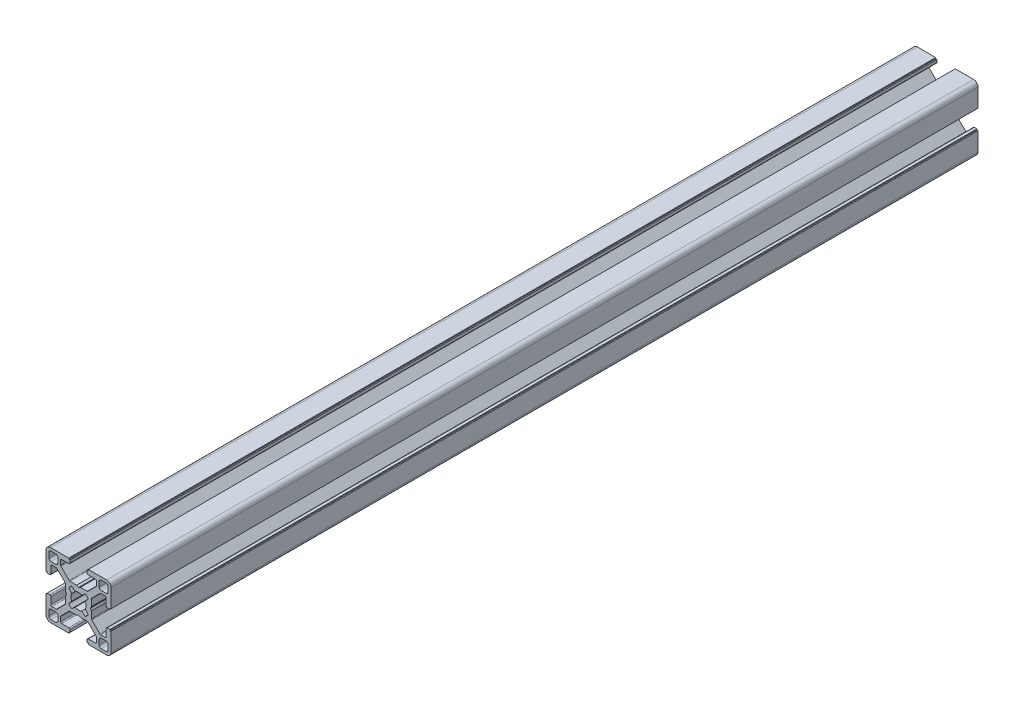
from build123d import *

# Parameters (mm, degrees)
BOSS_EXTRUDE1_DEPTH = 200
CIRPATTERN1_COUNT   = 4


with BuildPart() as part:
    # Sketch3 → Boss-Extrude1 (new, symmetric)
    with BuildSketch(Plane.XY):
        with BuildLine():
            Line((-4.503841895, 3.156803476), (-3.14772708, 1.530298739))
            ThreePointArc((-3.14772708, 1.530298739), (-3.410794979, 0.785160882), (-3.5, 0))
            Line((-3.5, 0), (-5.5, 0))
            Line((-5.5, 0), (-6, 0.866025404))
            Line((-6, 0.866025404), (-6, 3.996841995))
            ThreePointArc((-6, 3.996841995), (-6.038060234, 4.188183711), (-6.146446609, 4.350395385))
            Line((-6.146446609, 4.350395385), (-9.917104615, 8.121053391))
            ThreePointArc((-9.917104615, 8.121053391), (-10.079316289, 8.229439766), (-10.270658005, 8.2675))
            Line((-10.270658005, 8.2675), (-12.29, 8.2675))
            ThreePointArc((-12.29, 8.2675), (-12.643553391, 8.121053391), (-12.79, 7.7675))
            Line((-12.79, 7.7675), (-12.79, 4.5))
            ThreePointArc((-12.79, 4.5), (-12.936446609, 4.146446609), (-13.29, 4))
            Line((-13.29, 4), (-14.5, 4))
            Line((-14.5, 4), (-14.5, 4.5))
            Line((-14.5, 4.5), (-15, 4.5))
            Line((-15, 4.5), (-15, 12.968))
            ThreePointArc((-15, 12.968), (-14.404840979, 14.404840979), (-12.968, 15))
            Line((-12.968, 15), (-4.5, 15))
            Line((-4.5, 15), (-4.5, 14.5))
            Line((-4.5, 14.5), (-4, 14.5))
            Line((-4, 14.5), (-4, 13.29))
            ThreePointArc((-4, 13.29), (-4.146446609, 12.936446609), (-4.5, 12.79))
            Line((-4.5, 12.79), (-7.7675, 12.79))
            ThreePointArc((-7.7675, 12.79), (-8.121053391, 12.643553391), (-8.2675, 12.29))
            Line((-8.2675, 12.29), (-8.2675, 10.270658005))
            ThreePointArc((-8.2675, 10.270658005), (-8.229439766, 10.079316289), (-8.121053391, 9.917104615))
            Line((-8.121053391, 9.917104615), (-4.350395385, 6.146446609))
            ThreePointArc((-4.350395385, 6.146446609), (-4.188183711, 6.038060234), (-3.996841995, 6))
            Line((-3.996841995, 6), (-0.866025404, 6))
            Line((-0.866025404, 6), (0, 5.5))
            Line((0, 5.5), (0, 3.5))
            ThreePointArc((0, 3.5), (-0.785160882, 3.410794979), (-1.530298739, 3.14772708))
            Line((-1.530298739, 3.14772708), (-3.156803476, 4.503841895))
            ThreePointArc((-3.156803476, 4.503841895), (-3.889087297, 3.889087297), (-4.503841895, 3.156803476))
        make_face()
        with BuildLine():
            Line((-12.705, 9.5135), (-10.5135, 9.5135))
            ThreePointArc((-10.5135, 9.5135), (-9.806393219, 9.806393219), (-9.5135, 10.5135))
            Line((-9.5135, 10.5135), (-9.5135, 12.705))
            ThreePointArc((-9.5135, 12.705), (-9.806393219, 13.412106781), (-10.5135, 13.705))
            Line((-10.5135, 13.705), (-12.705, 13.705))
            ThreePointArc((-12.705, 13.705), (-13.412106781, 13.412106781), (-13.705, 12.705))
            Line((-13.705, 12.705), (-13.705, 10.5135))
            ThreePointArc((-13.705, 10.5135), (-13.412106781, 9.806393219), (-12.705, 9.5135))
        make_face(mode=Mode.SUBTRACT)
    boss_extrude1 = extrude(amount=BOSS_EXTRUDE1_DEPTH, both=True)

    # CirPattern1: Boss-Extrude1 ×4 about axis
    cirpattern1_axis = Axis((0, 0, 0), (0, 0, 1))
    for i in range(1, CIRPATTERN1_COUNT):
        add(boss_extrude1.rotate(cirpattern1_axis, i * 360 / CIRPATTERN1_COUNT))


solid = part.part
